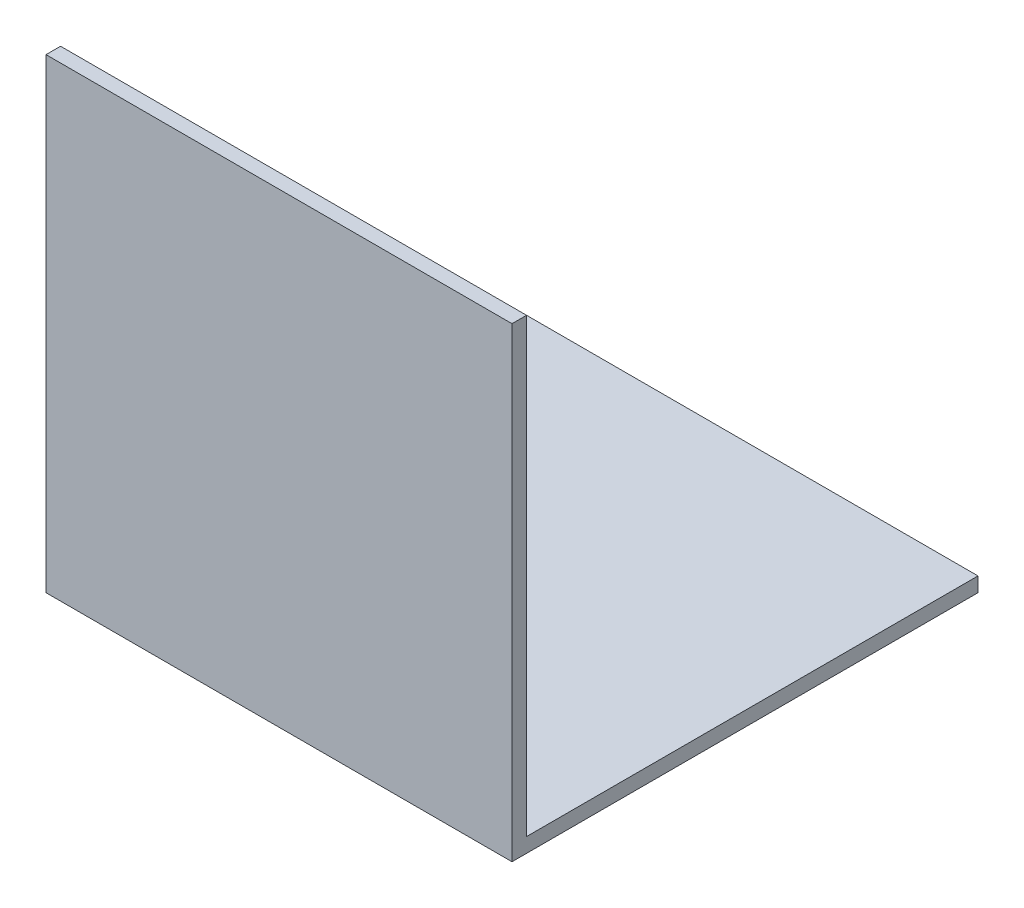
from build123d import *

# Parameters (mm, degrees)
SKETCH1_W           = 25.4
SKETCH1_H           = 25.4
BOSS_EXTRUDE1_DEPTH = 0.79375
SKETCH2_W           = 0.79375
SKETCH2_H           = 25.4
BOSS_EXTRUDE2_DEPTH = 25.4


with BuildPart() as part:
    # Sketch1 → Boss-Extrude1 (new body)
    with BuildSketch(Plane(origin=(0, 0, 0), x_dir=(1, 0, 0), z_dir=(0, 1, 0))):
        with Locations((12.7, 12.7)):
            Rectangle(SKETCH1_W, SKETCH1_H)
    extrude(amount=BOSS_EXTRUDE1_DEPTH)

    # Sketch2 → Boss-Extrude2 (add)
    with BuildSketch(Plane(origin=(25.4, 0, 0), x_dir=(0, 0, -1), z_dir=(1, 0, 0))):
        with Locations((0.396875, 12.7)):
            Rectangle(SKETCH2_W, SKETCH2_H)
    extrude(amount=-BOSS_EXTRUDE2_DEPTH)


solid = part.part
